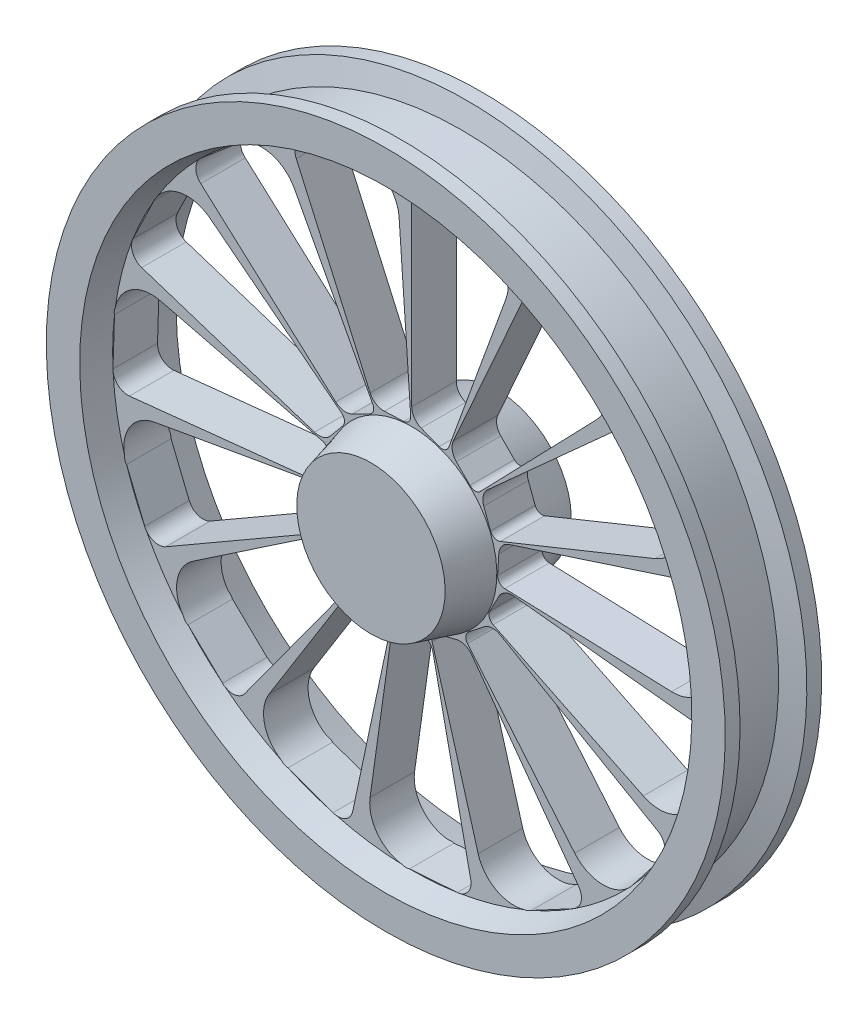
from build123d import *

# Parameters (mm, degrees)
CUT_EXTRUDE1_DEPTH = 130


with BuildPart() as part:
    # Sketch1 → Revolve1 (revolve)
    with BuildSketch(Plane(origin=(0, 0, 0), x_dir=(0, 0, -1), z_dir=(1, 0, 0)), mode=Mode.PRIVATE) as revolve1_sk:
        Polygon((-70.595013789, 0), (-70.595013789, 100), (-15.595013789, 114.737205584), (-15.595013789, 403.121778265), (-50.595013789, 412.5), (-50.595013789, 457.5), (-30.595013789, 457.5), (-22.556538016, 427.5), (51.366510438, 427.5), (59.404986211, 457.5), (79.404986211, 457.5), (79.404986211, 412.5), (44.404986211, 403.121778265), (44.404986211, 114.737205584), (99.404986211, 100), (99.404986211, 0), (14.404986211, 0), align=None)
    revolve(revolve1_sk.sketch.rotate(Axis((0, 0, 70.595013789), (0, 0, -1)), 180), axis=Axis((0, 0, 70.595013789), (0, 0, -1)))

    # Sketch2 → Cut-Extrude1 (cut, symmetric)
    with BuildSketch(Plane.XY):
        with BuildLine():
            ThreePointArc((-94.491056599, 83.256737574), (-90.707797077, 76.471572684), (-92.923402289, 69.025593317))
            Line((-92.923402289, 69.025593317), (-109.460654078, 48.91262783))
            ThreePointArc((-109.460654078, 48.91262783), (-119.300494082, 42.417240363), (-131.089532092, 42.593570947))
            Line((-131.089532092, 42.593570947), (-363.938172869, 118.250680576))
            ThreePointArc((-363.938172869, 118.250680576), (-376.156366242, 129.430001553), (-375.759537818, 145.986087866))
            Line((-375.759537818, 145.986087866), (-347.591760784, 204.174278367))
            ThreePointArc((-347.591760784, 204.174278367), (-313.907005875, 231.090421212), (-271.804424928, 221.789123637))
            Line((-271.804424928, 221.789123637), (-94.491056599, 83.256737574))
        make_face()
        with BuildLine():
            ThreePointArc((-52.458309589, 114.491789591), (-51.761905228, 106.754442748), (-56.814513958, 100.853369946))
            Line((-56.814513958, 100.853369946), (-80.102725276, 89.205567963))
            ThreePointArc((-80.102725276, 89.205567963), (-91.73377851, 87.27395974), (-102.431880524, 92.230079488))
            Line((-102.431880524, 92.230079488), (-284.377179829, 256.054362824))
            ThreePointArc((-284.377179829, 256.054362824), (-290.992015399, 271.236767678), (-283.895527625, 286.200100465))
            Line((-283.895527625, 286.200100465), (-234.495713593, 327.900790511))
            ThreePointArc((-234.495713593, 327.900790511), (-192.775377169, 338.78908641), (-158.095934141, 313.167265822))
            Line((-158.095934141, 313.167265822), (-52.458309589, 114.491789591))
        make_face()
        with BuildLine():
            ThreePointArc((-1.355044283, 125.930171062), (-3.865909723, 118.578499828), (-10.88188002, 115.242682687))
            Line((-10.88188002, 115.242682687), (-36.894307563, 114.074054989))
            ThreePointArc((-36.894307563, 114.074054989), (-48.305459258, 117.040218618), (-56.062826248, 125.919169403))
            Line((-56.062826248, 125.919169403), (-155.64478891, 349.583919558))
            ThreePointArc((-155.64478891, 349.583919558), (-155.512501514, 366.144232564), (-142.943401596, 376.927515647))
            Line((-142.943401596, 376.927515647), (-80.853227195, 394.930277092))
            ThreePointArc((-80.853227195, 394.930277092), (-38.31113444, 387.908040766), (-17.051220085, 350.39594271))
            Line((-17.051220085, 350.39594271), (-1.355044283, 125.930171062))
        make_face()
        with BuildLine():
            Line((0, 382.66724073), (0, 137.835690988))
            ThreePointArc((0, 137.835690988), (3.475312742, 126.569160421), (12.693471101, 119.218101577))
            Line((12.693471101, 119.218101577), (36.932329833, 109.705488645))
            ThreePointArc((36.932329833, 109.705488645), (44.698536693, 109.899257035), (49.98252049, 115.594081916))
            Line((49.98252049, 115.594081916), (126.94180483, 327.037977857))
            ThreePointArc((126.94180483, 327.037977857), (122.777451478, 369.95417084), (86.769516713, 393.672730934))
            Line((86.769516713, 393.672730934), (22.724937169, 402.480739095))
            ThreePointArc((22.724937169, 402.480739095), (6.85653667, 397.742033323), (0, 382.66724073))
        make_face()
        with BuildLine():
            ThreePointArc((92.677653393, 85.270725869), (85.534200042, 82.217434297), (78.360604337, 85.199218973))
            Line((78.360604337, 85.199218973), (60.086433295, 103.74825534))
            ThreePointArc((60.086433295, 103.74825534), (54.655171595, 114.213144542), (56.062826248, 125.919169403))
            Line((56.062826248, 125.919169403), (155.64478891, 349.583919558))
            ThreePointArc((155.64478891, 349.583919558), (168.040017374, 360.566623147), (184.463927848, 358.44138633))
            Line((184.463927848, 358.44138633), (239.389022906, 324.345593193))
            ThreePointArc((239.389022906, 324.345593193), (262.636700638, 288.031863847), (248.985438459, 247.132175586))
            Line((248.985438459, 247.132175586), (92.677653393, 85.270725869))
        make_face()
        with BuildLine():
            ThreePointArc((119.347978075, 40.203286658), (111.58022315, 40.319470248), (106.239618468, 45.96123033))
            Line((106.239618468, 45.96123033), (97.089905305, 70.339393231))
            ThreePointArc((97.089905305, 70.339393231), (96.384654754, 82.108638378), (102.431880524, 92.230079488))
            Line((102.431880524, 92.230079488), (284.377179829, 256.054362824))
            ThreePointArc((284.377179829, 256.054362824), (300.167852478, 261.045968185), (314.3074296, 252.424261532))
            Line((314.3074296, 252.424261532), (350.615992257, 198.936155802))
            ThreePointArc((350.615992257, 198.936155802), (357.083678278, 156.306230908), (327.977227817, 124.49497503))
            Line((327.977227817, 124.49497503), (119.347978075, 40.203286658))
        make_face()
        with BuildLine():
            ThreePointArc((125.381953105, -11.815666051), (118.333012001, -8.550096498), (115.748837409, -1.223872582))
            Line((115.748837409, -1.223872582), (117.305650653, 24.76821102))
            ThreePointArc((117.305650653, 24.76821102), (121.448355478, 35.806802705), (131.089532092, 42.593570947))
            Line((131.089532092, 42.593570947), (363.938172869, 118.250680576))
            ThreePointArc((363.938172869, 118.250680576), (380.393938949, 116.388093795), (389.804321381, 102.760688712))
            Line((389.804321381, 102.760688712), (401.2182713, 39.128849794))
            ThreePointArc((401.2182713, 39.128849794), (389.787643941, -2.446169353), (350.258774906, -19.66853771))
            Line((350.258774906, -19.66853771), (125.381953105, -11.815666051))
        make_face()
        with BuildLine():
            ThreePointArc((109.736249384, -61.791582759), (104.624948055, -55.941273885), (105.244030817, -48.197356806))
            Line((105.244030817, -48.197356806), (117.238183315, -25.08561989))
            ThreePointArc((117.238183315, -25.08561989), (125.512532217, -16.686354451), (137.08061265, -14.407752962))
            Line((137.08061265, -14.407752962), (380.570949547, -39.999618616))
            ThreePointArc((380.570949547, -39.999618616), (394.846457606, -48.394339365), (397.900504733, -64.671140738))
            Line((397.900504733, -64.671140738), (382.446266282, -127.444189817))
            ThreePointArc((382.446266282, -127.444189817), (355.093784856, -160.77560471), (311.977397813, -160.431181596))
            Line((311.977397813, -160.431181596), (109.736249384, -61.791582759))
        make_face()
        with BuildLine():
            ThreePointArc((75.116151222, -101.083173448), (72.826280102, -93.659696806), (76.541575184, -86.837080178))
            Line((76.541575184, -86.837080178), (96.899169006, -70.601919224))
            ThreePointArc((96.899169006, -70.601919224), (107.874451889, -66.294289331), (119.369209943, -68.917845494))
            Line((119.369209943, -68.917845494), (331.399551669, -191.333620365))
            ThreePointArc((331.399551669, -191.333620365), (341.026436675, -204.808951599), (337.196076005, -220.920742435))
            Line((337.196076005, -220.920742435), (297.545827409, -271.980971215))
            ThreePointArc((297.545827409, -271.980971215), (259.000984444, -291.305477412), (219.752294412, -273.453816713))
            Line((219.752294412, -273.453816713), (75.116151222, -101.083173448))
        make_face()
        with BuildLine():
            ThreePointArc((27.507788105, -122.896565136), (28.435286714, -115.183507278), (34.604385844, -110.461883498))
            Line((34.604385844, -110.461883498), (59.805408075, -103.910505327))
            ThreePointArc((59.805408075, -103.910505327), (71.583898822, -104.439339321), (81.017786402, -111.51141644))
            Line((81.017786402, -111.51141644), (224.926160637, -309.584300942))
            ThreePointArc((224.926160637, -309.584300942), (228.239846715, -325.810235472), (218.187382406, -338.971140763))
            Line((218.187382406, -338.971140763), (161.197011858, -369.48977182))
            ThreePointArc((161.197011858, -369.48977182), (118.124560872, -371.465986642), (89.53002292, -339.193802671))
            Line((89.53002292, -339.193802671), (27.507788105, -122.896565136))
        make_face()
        with BuildLine():
            ThreePointArc((-24.856921476, -123.460024232), (-20.872426073, -116.791042932), (-13.316216179, -114.986823646))
            Line((-13.316216179, -114.986823646), (12.370748773, -119.252021061))
            ThreePointArc((12.370748773, -119.252021061), (22.915839329, -124.525878741), (28.657651568, -134.823650435))
            Line((28.657651568, -134.823650435), (79.560993041, -374.3050434))
            ThreePointArc((79.560993041, -374.3050434), (75.988513764, -390.475969738), (61.452108218, -398.410349398))
            Line((61.452108218, -398.410349398), (-3.024231473, -403.110434168))
            ThreePointArc((-3.024231473, -403.110434168), (-43.176672403, -387.39665212), (-56.172802889, -346.284098667))
            Line((-56.172802889, -346.284098667), (-24.856921476, -123.460024232))
        make_face()
        with BuildLine():
            ThreePointArc((-72.923643516, -102.676123539), (-66.571106773, -98.20434625), (-58.934323451, -99.629497364))
            Line((-58.934323451, -99.629497364), (-37.202925377, -113.973778983))
            ThreePointArc((-37.202925377, -113.973778983), (-29.714576968, -123.080762444), (-28.657651568, -134.823650435))
            Line((-28.657651568, -134.823650435), (-79.560993041, -374.3050434))
            ThreePointArc((-79.560993041, -374.3050434), (-89.40192355, -387.624861473), (-105.908793756, -388.960789176))
            Line((-105.908793756, -388.960789176), (-166.722557707, -367.029640306))
            ThreePointArc((-166.722557707, -367.029640306), (-197.012266772, -336.342917057), (-192.162840765, -293.498728112))
            Line((-192.162840765, -293.498728112), (-72.923643516, -102.676123539))
        make_face()
        with BuildLine():
            ThreePointArc((-108.381205101, -64.138588303), (-100.759038332, -62.637225943), (-94.362150797, -67.045325881))
            Line((-94.362150797, -67.045325881), (-80.343875752, -88.9884351))
            ThreePointArc((-80.343875752, -88.9884351), (-77.207072959, -100.353864168), (-81.017786402, -111.51141644))
            Line((-81.017786402, -111.51141644), (-224.926160637, -309.584300942))
            ThreePointArc((-224.926160637, -309.584300942), (-239.333956092, -317.749893199), (-254.957103138, -312.256374909))
            Line((-254.957103138, -312.256374909), (-301.593039087, -267.486087275))
            ThreePointArc((-301.593039087, -267.486087275), (-316.782650416, -227.132436056), (-294.926177728, -189.964761114))
            Line((-294.926177728, -189.964761114), (-108.381205101, -64.138588303))
        make_face()
        with BuildLine():
            ThreePointArc((-125.098671712, -14.510908469), (-117.524816796, -16.239560229), (-113.473905017, -22.868408466))
            Line((-113.473905017, -22.868408466), (-109.592640107, -48.616182353))
            ThreePointArc((-109.592640107, -48.616182353), (-111.349764631, -60.27487109), (-119.369209943, -68.917845494))
            Line((-119.369209943, -68.917845494), (-331.399551669, -191.333620365))
            ThreePointArc((-331.399551669, -191.333620365), (-347.882973345, -192.933081723), (-359.921013174, -181.559996659))
            Line((-359.921013174, -181.559996659), (-384.315344122, -121.691759719))
            ThreePointArc((-384.315344122, -121.691759719), (-381.778435922, -78.648693428), (-346.694099241, -53.584161144))
            Line((-346.694099241, -53.584161144), (-125.098671712, -14.510908469))
        make_face()
        with BuildLine():
            ThreePointArc((-120.185441498, 37.625839267), (-113.969486757, 32.96607298), (-112.964990181, 25.262664525))
            Line((-112.964990181, 25.262664525), (-119.891841371, 0.162249987))
            ThreePointArc((-119.891841371, 0.162249987), (-126.239070417, -9.773805221), (-137.08061265, -14.407752962))
            Line((-137.08061265, -14.407752962), (-380.570949547, -39.999618616))
            ThreePointArc((-380.570949547, -39.999618616), (-396.279864089, -34.756387675), (-402.651310254, -19.470245567))
            Line((-402.651310254, -19.470245567), (-400.586034764, 45.144178627))
            ThreePointArc((-400.586034764, 45.144178627), (-380.76126151, 83.434122795), (-338.515461379, 92.061627085))
            Line((-338.515461379, 92.061627085), (-120.185441498, 37.625839267))
        make_face()
    extrude(amount=CUT_EXTRUDE1_DEPTH, both=True, mode=Mode.SUBTRACT)


solid = part.part
